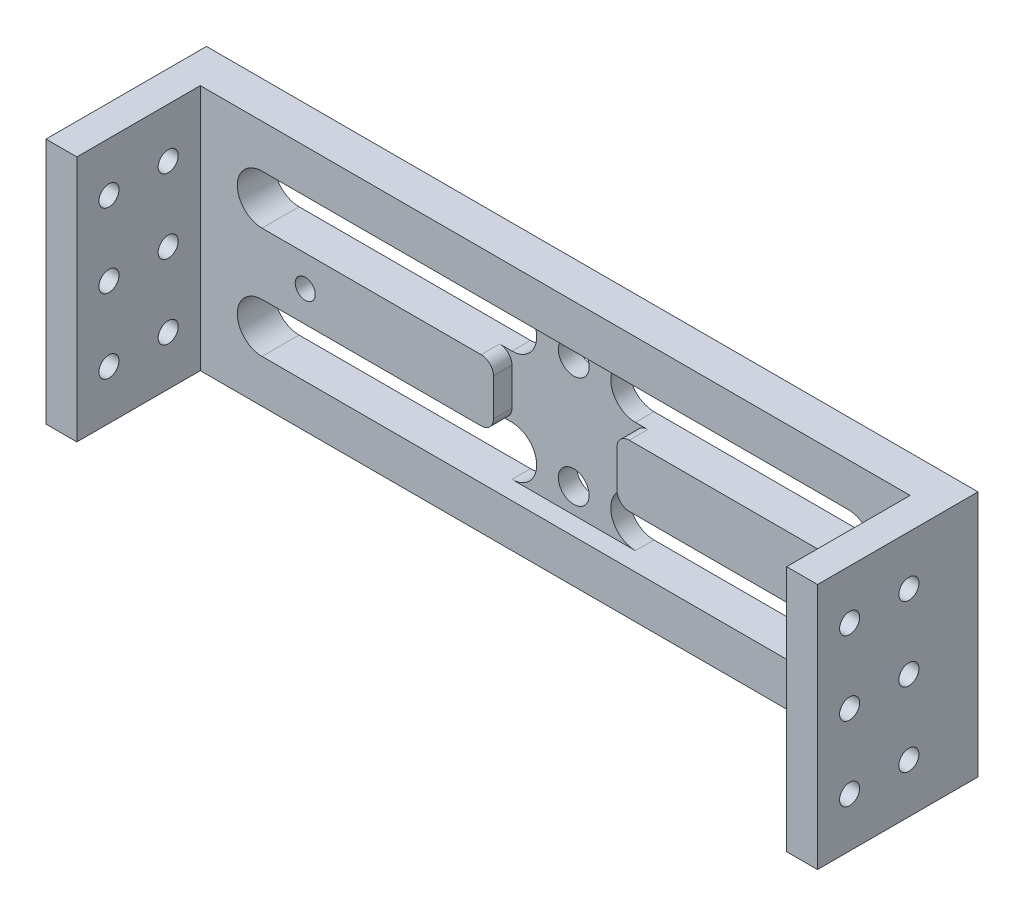
from build123d import *

# Parameters (mm, degrees)
ESBO_O1_W                   = 65
ESBO_O1_H                   = 40
RESSALTO_EXTRUS_O1_DEPTH    = 6
RESSALTO_EXTRUS_O2_DEPTH    = 4
CORTE_EXTRUS_O1_DEPTH       = 78.852424497
ESBO_O5_W                   = 5
ESBO_O5_H                   = 40
RESSALTO_EXTRUS_O4_DEPTH    = 20
CORTE_EXTRUS_O3_DEPTH       = 1.2
RESSALTO_EXTRUS_O5_DEPTH    = 4
CORTE_EXTRUS_O4_DEPTH       = 56.029537523
ESBO_O12_W                  = 6
ESBO_O12_H                  = 5
RESSALTO_EXTRUS_O6_DEPTH    = 65
ESBO_O13_W                  = 3
ESBO_O13_H                  = 5
RESSALTO_EXTRUS_O7_DEPTH    = 18
ESBO_O15_R                  = 1.625
CORTE_EXTRUS_O5_DEPTH       = 5
CORTE_EXTRUS_O6_DEPTH       = 6
ESBO_O19_R                  = 2.875
CORTE_EXTRUS_O7_DEPTH       = 1.5
ESBO_O22_R                  = 1.625
CORTE_EXTRUS_O10_DEPTH      = 4
CORTE_EXTRUS_O8_DEPTH       = 3
ESBO_O21_R                  = 2.5
CORTE_EXTRUS_O9_DEPTH       = 3
FILETE1_R                   = 2
CORTE_EXTRUS_O11_DEPTH      = 112.477576221
CORTE_EXTRUS_O11_DEPTH_BACK = 112.477576221
ESBO_O23_W                  = 130
ESBO_O23_H                  = 30
ESBO_O24_W                  = 6.5
ESBO_O24_H                  = 40
CORTE_EXTRUS_O12_DEPTH      = 110.536523589


with BuildPart() as part:
    # Esboço1 → Ressalto-extrusão1 (new body)
    with BuildSketch(Plane.XY):
        Rectangle(ESBO_O1_W, ESBO_O1_H)
    extrude(amount=RESSALTO_EXTRUS_O1_DEPTH)

    # Esboço2 → Ressalto-extrusão2 (add)
    with BuildSketch(Plane.ZY.offset(32.5)):
        Polygon((0, 20), (-30, 20), (-30, -20), (0, -20), (6, -20), (6, 20), align=None)
    extrude(amount=RESSALTO_EXTRUS_O2_DEPTH)

    # Esboço3 → Corte-extrusão1 (cut, through all)
    with BuildSketch(Plane.ZY.offset(36.5)):
        with BuildLine():
            Line((-15, 3.125), (-30, 3.125))
            Line((-30, 3.125), (-30, -3.125))
            Line((-30, -3.125), (-15, -3.125))
            ThreePointArc((-15, -3.125), (-11.875, 0), (-15, 3.125))
        make_face()
    extrude(amount=-CORTE_EXTRUS_O1_DEPTH, mode=Mode.SUBTRACT)

    # Esboço5 → Ressalto-extrusão4 (add)
    with BuildSketch(Plane.XY.offset(6)):
        with Locations((-27.5, 0)):
            Rectangle(ESBO_O5_W, ESBO_O5_H)
    extrude(amount=RESSALTO_EXTRUS_O4_DEPTH)

    # Esboço7 → Corte-extrusão3 (cut)
    with BuildSketch(Plane(origin=(-32.5, 0, 0), x_dir=(0, 0, -1), z_dir=(1, 0, 0))):
        with BuildLine():
            Line((15, -6.625), (30, -6.625))
            Line((30, -6.625), (30, 6.625))
            Line((30, 6.625), (15, 6.625))
            ThreePointArc((15, 6.625), (8.375, 0), (15, -6.625))
        make_face()
    extrude(amount=-CORTE_EXTRUS_O3_DEPTH, mode=Mode.SUBTRACT)

    # Esboço8 → Ressalto-extrusão5 (add)
    with BuildSketch(Plane(origin=(-32.5, 0, 0), x_dir=(0, 0, -1), z_dir=(1, 0, 0))):
        with BuildLine():
            Line((25.74709263, -6.625), (28.03840481, -6.625))
            ThreePointArc((28.03840481, -6.625), (0.375, 0), (28.03840481, 6.625))
            Line((28.03840481, 6.625), (25.74709263, 6.625))
            ThreePointArc((25.74709263, 6.625), (2.375, 0), (25.74709263, -6.625))
        make_face()
    extrude(amount=RESSALTO_EXTRUS_O5_DEPTH)

    # Esboço11 → Corte-extrusão4 (cut, through all)
    with BuildSketch(Plane.XY.offset(6)):
        with BuildLine():
            Line((-15, 13), (22.5, 13))
            ThreePointArc((22.5, 13), (26.5, 9), (22.5, 5))
            Line((22.5, 5), (-15, 5))
            ThreePointArc((-15, 5), (-19, 9), (-15, 13))
        make_face()
        with BuildLine():
            Line((-15, -5), (22.5, -5))
            ThreePointArc((22.5, -5), (26.5, -9), (22.5, -13))
            Line((22.5, -13), (-15, -13))
            ThreePointArc((-15, -13), (-19, -9), (-15, -5))
        make_face()
    extrude(amount=-CORTE_EXTRUS_O4_DEPTH, mode=Mode.SUBTRACT)

    # Esboço12 → Ressalto-extrusão6 (add)
    with BuildSketch(Plane(origin=(-32.5, 0, 0), x_dir=(0, 0, -1), z_dir=(1, 0, 0))):
        with Locations((3, -17.5)):
            Rectangle(ESBO_O12_W, ESBO_O12_H)
        with Locations((27, -17.5)):
            Rectangle(ESBO_O12_W, ESBO_O12_H)
    ressalto_extrus_o6 = extrude(amount=RESSALTO_EXTRUS_O6_DEPTH)

    # Esboço13 → Ressalto-extrusão7 (add)
    with BuildSketch(Plane.XY.offset(-24)):
        with Locations((31, -17.5)):
            Rectangle(ESBO_O13_W, ESBO_O13_H)
    ressalto_extrus_o7 = extrude(amount=RESSALTO_EXTRUS_O7_DEPTH)

    # Espelhar2: Ressalto-extrusão6, Ressalto-extrusão7 across plane
    add(ressalto_extrus_o6.mirror(Plane.ZX))
    add(ressalto_extrus_o7.mirror(Plane.ZX))

    # Esboço15 → Corte-extrusão5 (cut)
    with BuildSketch(Plane.ZY.offset(30)):
        with Locations(Location((20.8, 12, 0), (0, 0, 270))):
            Circle(ESBO_O15_R)
        with Locations(Location((11.2, 12, 0), (0, 0, 270))):
            Circle(ESBO_O15_R)
        with Locations(Location((20.8, 0, 0), (0, 0, 270))):
            Circle(ESBO_O15_R)
        with Locations(Location((11.2, 0, 0), (0, 0, 270))):
            Circle(ESBO_O15_R)
        with Locations(Location((20.8, -12, 0), (0, 0, 270))):
            Circle(ESBO_O15_R)
        with Locations(Location((11.2, -12, 0), (0, 0, 270))):
            Circle(ESBO_O15_R)
    extrude(amount=-CORTE_EXTRUS_O5_DEPTH, mode=Mode.SUBTRACT)

    # Esboço18 → Corte-extrusão6 (cut)
    with BuildSketch(Plane.XY.offset(6)):
        with BuildLine():
            ThreePointArc((-9.625, 0), (-8, -1.625), (-6.375, 0))
            Line((-6.375, 0), (-9.625, 0))
        make_face()
        with BuildLine():
            Line((-9.625, 0), (-6.375, 0))
            ThreePointArc((-6.375, 0), (-8, 1.625), (-9.625, 0))
        make_face()
    extrude(amount=-CORTE_EXTRUS_O6_DEPTH, mode=Mode.SUBTRACT)

    # Esboço19 → Corte-extrusão7 (cut)
    with BuildSketch(Plane(origin=(0, 0, 0), x_dir=(-1, 0, 0), z_dir=(0, 0, -1))):
        with Locations((8, 0)):
            Circle(ESBO_O19_R)
    extrude(amount=-CORTE_EXTRUS_O7_DEPTH, mode=Mode.SUBTRACT)

    # Esboço22 → Corte-extrusão10 (cut)
    with BuildSketch(Plane.ZY.offset(36.5)):
        with Locations((-8.98959236, 6.01040764)):
            Circle(ESBO_O22_R)
        with Locations((-21.01040764, 6.01040764)):
            Circle(ESBO_O22_R)
        with Locations((-21.01040764, -6.01040764)):
            Circle(ESBO_O22_R)
        with Locations((-8.98959236, -6.01040764)):
            Circle(ESBO_O22_R)
    extrude(amount=-CORTE_EXTRUS_O10_DEPTH, mode=Mode.SUBTRACT)

    # Espelhar3: part across plane


with BuildPart() as part_1:
    add(part.part)
    add(part.part.mirror(Plane(origin=(32.5, 0, 0), x_dir=(0, 0, 1), z_dir=(1, 0, 0))))

    # Esboço20 → Corte-extrusão8 (cut)
    with BuildSketch(Plane.XY.offset(6)):
        Polygon((42.5, -13), (22.5, -13), (22.5, -5), (22.5, 5), (22.5, 13), (42.5, 13), (42.5, 5), (42.5, -5), align=None)
    extrude(amount=-CORTE_EXTRUS_O8_DEPTH, mode=Mode.SUBTRACT)

    # Esboço21 → Corte-extrusão9 (cut)
    with BuildSketch(Plane.XY.offset(3)):
        with Locations((32.5, 9)):
            Circle(ESBO_O21_R)
        with Locations((32.5, -9)):
            Circle(ESBO_O21_R)
    extrude(amount=-CORTE_EXTRUS_O9_DEPTH, mode=Mode.SUBTRACT)

    # Filete1
    filete1_edges = [part_1.edges().sort_by_distance(p)[0] for p in [
        (42.5, 5, 4.5),
        (22.5, 5, 4.5),
        (22.5, -5, 4.5),
        (42.5, -5, 4.5),
    ]]
    fillet(filete1_edges, radius=FILETE1_R)

    # Esboço23 → Corte-extrusão11 (cut, two sides: drawn at the far end of the back side and taken through both)
    with BuildSketch(Plane(origin=(0, -15, 0), x_dir=(1, 0, 0), z_dir=(0, 1, 0)).offset(-CORTE_EXTRUS_O11_DEPTH_BACK)):
        with Locations((32.5, 15)):
            Rectangle(ESBO_O23_W, ESBO_O23_H)
    extrude(amount=CORTE_EXTRUS_O11_DEPTH + CORTE_EXTRUS_O11_DEPTH_BACK, mode=Mode.SUBTRACT)

    # Esboço24 → Corte-extrusão12 (cut, through all)
    with BuildSketch(Plane.XY.offset(6)):
        with Locations((98.25, 0)):
            Rectangle(ESBO_O24_W, ESBO_O24_H)
        with Locations((-33.25, 0)):
            Rectangle(ESBO_O24_W, ESBO_O24_H)
    extrude(amount=-CORTE_EXTRUS_O12_DEPTH, mode=Mode.SUBTRACT)


solid = part_1.part
